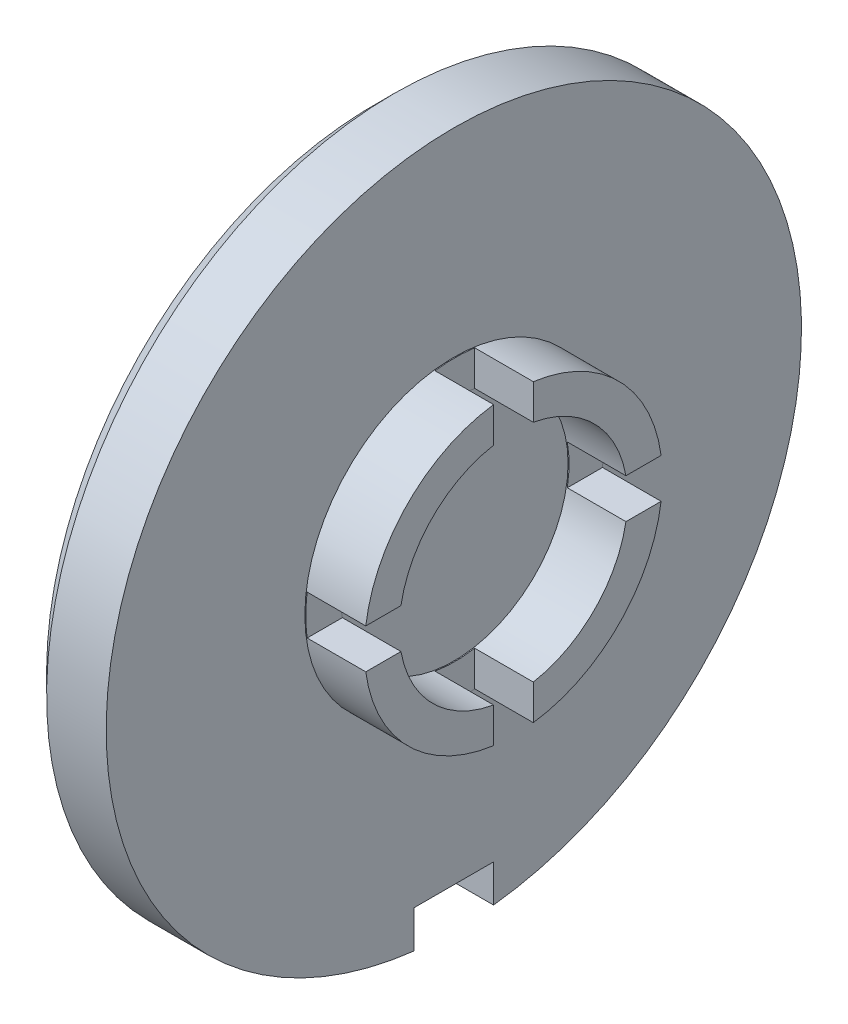
from build123d import *

# Parameters (mm, degrees)
BOSS_EXTRUDE1_START = -55.2
SKETCH2_W           = 1.28
SKETCH2_H           = 0.8
BOSS_EXTRUDE1_DEPTH = 6.4
BOSS_EXTRUDE2_START = -52.4
SKETCH3_W           = 1.28
SKETCH3_H           = 6.4
BOSS_EXTRUDE2_DEPTH = 0.8
BOSS_EXTRUDE3_START = -52.8
SKETCH4_W           = 1.8
SKETCH4_H           = 0.9
BOSS_EXTRUDE3_DEPTH = 1.6


with BuildPart() as part:
    # Sketch1 → Revolve1 (revolve)
    with BuildSketch(Plane.XY.offset(-52), mode=Mode.PRIVATE) as revolve1_sk:
        Polygon((-82.8, -62.7), (-84, -62.7), (-84, -65), (-85.6, -65), (-85.6, -58.4), (-85.2, -58), (-84, -58), (-84, -62), (-82.8, -62), align=None)
    revolve(revolve1_sk.sketch.rotate(Axis((-90.6, -65, -52), (1, 0, 0)), 90), axis=Axis((-90.6, -65, -52), (1, 0, 0)))


with BuildPart() as body_2:
    # Sketch2 → Boss-Extrude1 (new body)
    with BuildSketch(Plane.XY.offset(BOSS_EXTRUDE1_START)):
        with Locations((-83.34, -65)):
            Rectangle(SKETCH2_W, SKETCH2_H)
    extrude(amount=BOSS_EXTRUDE1_DEPTH)


with BuildPart() as part_1:
    add(part.part)

    # Combine1: cut body 2
    add(body_2.part, mode=Mode.SUBTRACT)


with BuildPart() as body_2_2:
    # Sketch3 → Boss-Extrude2 (new body)
    with BuildSketch(Plane.XY.offset(BOSS_EXTRUDE2_START)):
        with Locations((-83.34, -65)):
            Rectangle(SKETCH3_W, SKETCH3_H)
    extrude(amount=BOSS_EXTRUDE2_DEPTH)


with BuildPart() as part_2:
    add(part_1.part)

    # Combine2: cut body 2 2
    add(body_2_2.part, mode=Mode.SUBTRACT)


with BuildPart() as body_2_3:
    # Sketch4 → Boss-Extrude3 (new body)
    with BuildSketch(Plane.XY.offset(BOSS_EXTRUDE3_START)):
        with Locations((-84.8, -71.65)):
            Rectangle(SKETCH4_W, SKETCH4_H)
    extrude(amount=BOSS_EXTRUDE3_DEPTH)


with BuildPart() as part_3:
    add(part_2.part)

    # Combine3: cut body 2 3
    add(body_2_3.part, mode=Mode.SUBTRACT)


solid = part_3.part
